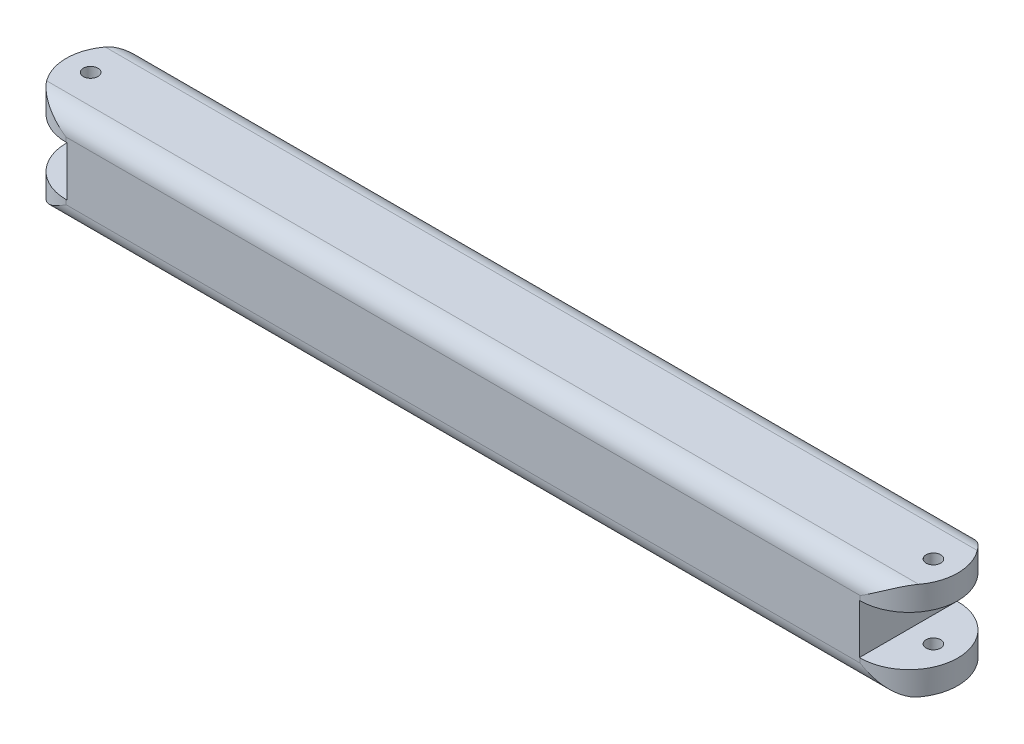
from build123d import *

# Parameters (mm, degrees)
BOSS_EXTRUDE1_DEPTH = 228.4
SKETCH2_W           = 25.4
SKETCH2_H           = 25.4
CUT_EXTRUDE1_DEPTH  = 25
SKETCH4_R           = 3.75
CUT_EXTRUDE6_DEPTH  = 25


with BuildPart() as part:
    # Sketch1 → Boss-Extrude1 (new, symmetric)
    with BuildSketch(Plane(origin=(0, 0, 0), x_dir=(0, 0, -1), z_dir=(1, 0, 0))):
        with BuildLine():
            Line((-15, 25), (15, 25))
            ThreePointArc((15, 25), (22.071067812, 22.071067812), (25, 15))
            Line((25, 15), (25, -15))
            ThreePointArc((25, -15), (22.071067812, -22.071067812), (15, -25))
            Line((15, -25), (-15, -25))
            ThreePointArc((-15, -25), (-22.071067812, -22.071067812), (-25, -15))
            Line((-25, -15), (-25, 15))
            ThreePointArc((-25, 15), (-22.071067812, 22.071067812), (-15, 25))
        make_face()
    extrude(amount=BOSS_EXTRUDE1_DEPTH, both=True)

    # Sketch2 → Cut-Extrude1 (cut, symmetric)
    with BuildSketch(Plane.XY):
        with Locations((215.7, 0)):
            Rectangle(SKETCH2_W, SKETCH2_H)
        with Locations((-215.7, 0)):
            Rectangle(SKETCH2_W, SKETCH2_H)
    extrude(amount=CUT_EXTRUDE1_DEPTH, both=True, mode=Mode.SUBTRACT)

    # Sketch4 → Cut-Extrude6 (cut, symmetric)
    with BuildSketch(Plane(origin=(0, 0, 0), x_dir=(1, 0, 0), z_dir=(0, 1, 0))):
        with Locations(Location((-215.9, 0, 0), (0, 0, 270))):
            Circle(SKETCH4_R)
        with Locations(Location((215.9, 0, 0), (0, 0, 270))):
            Circle(SKETCH4_R)
        with BuildLine():
            Line((-203.4, 25), (-203.4, 45))
            ThreePointArc((-203.4, 45), (-248.4, 0), (-203.4, -45))
            Line((-203.4, -45), (-203.4, -25))
            ThreePointArc((-203.4, -25), (-228.4, 0), (-203.4, 25))
        make_face()
        with BuildLine():
            Line((203.4, 45), (203.4, 25))
            ThreePointArc((203.4, 25), (228.4, 0), (203.4, -25))
            Line((203.4, -25), (203.4, -45))
            ThreePointArc((203.4, -45), (248.4, 0), (203.4, 45))
        make_face()
    extrude(amount=CUT_EXTRUDE6_DEPTH, both=True, mode=Mode.SUBTRACT)


solid = part.part
